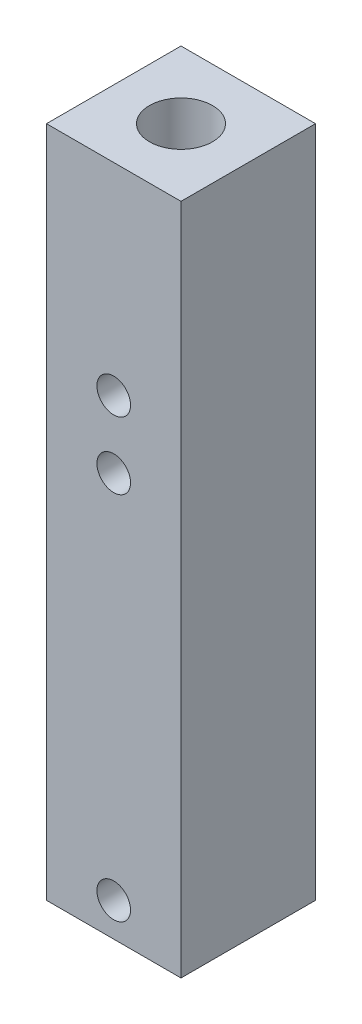
from build123d import *

# Parameters (mm, degrees)
SKETCH1_W           = 20
SKETCH1_H           = 20
SKETCH1_R           = 4.683092763
BOSS_EXTRUDE1_DEPTH = 100
SKETCH2_R           = 2.5
CUT_EXTRUDE1_DEPTH  = 100
SKETCH3_R           = 2.5
CUT_EXTRUDE2_DEPTH  = 103.469507777


with BuildPart() as part:
    # Sketch1 → Boss-Extrude1 (new body)
    with BuildSketch(Plane(origin=(0, 0, 0), x_dir=(1, 0, 0), z_dir=(0, 1, 0))):
        Rectangle(SKETCH1_W, SKETCH1_H)
        with Locations(Location((0, 0, 0), (0, 0, 270))):
            Circle(SKETCH1_R, mode=Mode.SUBTRACT)
    extrude(amount=BOSS_EXTRUDE1_DEPTH)

    # Sketch2 → Cut-Extrude1 (cut)
    with BuildSketch(Plane.XY.offset(10)):
        with Locations((0, 5)):
            Circle(SKETCH2_R)
    extrude(amount=-CUT_EXTRUDE1_DEPTH, mode=Mode.SUBTRACT)

    # Sketch3 → Cut-Extrude2 (cut, through all)
    with BuildSketch(Plane.XY.offset(10)):
        with Locations((0, 60)):
            Circle(SKETCH3_R)
        with Locations((0, 70)):
            Circle(SKETCH3_R)
    extrude(amount=-CUT_EXTRUDE2_DEPTH, mode=Mode.SUBTRACT)


solid = part.part
